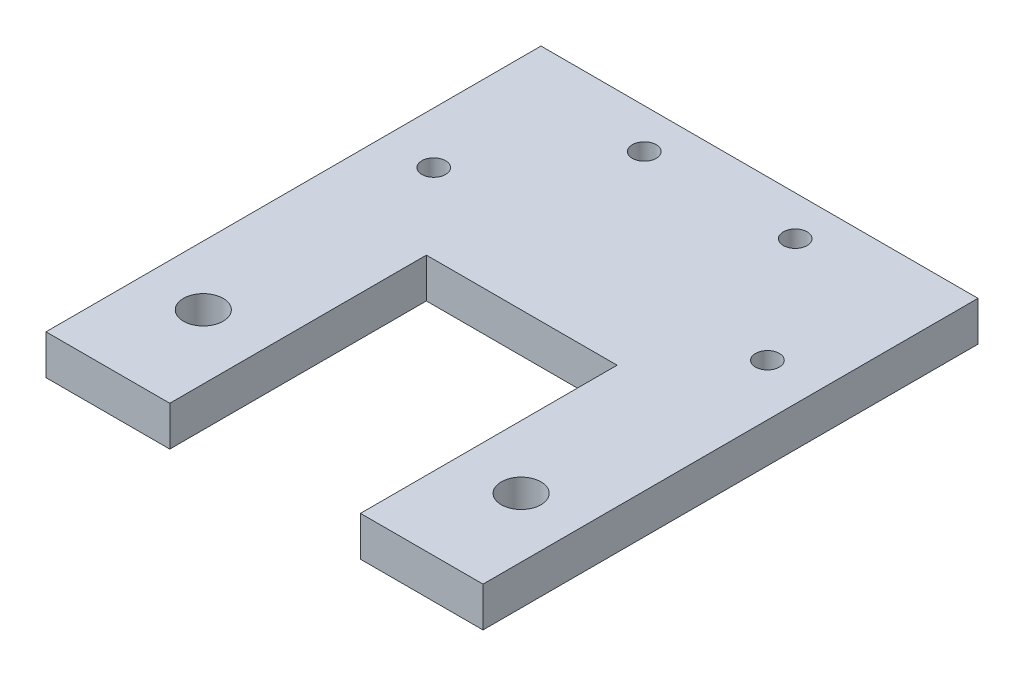
from build123d import *

# Parameters (mm, degrees)
SKETCH1_W           = 65
SKETCH1_H           = 100
BOSS_EXTRUDE1_DEPTH = 5
SKETCH3_R           = 1.5
SKETCH3_R_2         = 2.5
CUT_EXTRUDE2_DEPTH  = 5
SKETCH5_W           = 24
SKETCH5_H           = 70
CUT_EXTRUDE4_DEPTH  = 5
SKETCH6_W           = 65
SKETCH6_H           = 10
CUT_EXTRUDE5_DEPTH  = 5
SKETCH7_W           = 20.576460324
SKETCH7_H           = 27.703955477
CUT_EXTRUDE6_DEPTH  = 5
SKETCH8_W           = 20.423539676
SKETCH8_H           = 27.703955477
CUT_EXTRUDE7_DEPTH  = 5
CUT_EXTRUDE8_DEPTH  = 5
SKETCH10_W          = 5
SKETCH10_H          = 62.296044523
CUT_EXTRUDE9_DEPTH  = 5


with BuildPart() as part:
    # Sketch1 → Boss-Extrude1 (new body)
    with BuildSketch(Plane(origin=(0, 0, 0), x_dir=(1, 0, 0), z_dir=(0, 1, 0))):
        Rectangle(SKETCH1_W, SKETCH1_H)
    extrude(amount=BOSS_EXTRUDE1_DEPTH)

    # Sketch3 → Cut-Extrude2 (cut)
    with BuildSketch(Plane(origin=(0, 5, 0), x_dir=(1, 0, 0), z_dir=(0, 1, 0))):
        with Locations(Location((-21, 30, 0), (0, 0, 270))):
            Circle(SKETCH3_R)
        with Locations(Location((21, 30, 0), (0, 0, 270))):
            Circle(SKETCH3_R)
        with Locations(Location((-9.5, 45, 0), (0, 0, 270))):
            Circle(SKETCH3_R)
        with Locations(Location((9.5, 45, 0), (0, 0, 270))):
            Circle(SKETCH3_R)
        with Locations(Location((-20, 0, 0), (0, 0, 270))):
            Circle(SKETCH3_R_2)
        with Locations(Location((20, 0, 0), (0, 0, 270))):
            Circle(SKETCH3_R_2)
    extrude(amount=-CUT_EXTRUDE2_DEPTH, mode=Mode.SUBTRACT)

    # Sketch5 → Cut-Extrude4 (cut)
    with BuildSketch(Plane(origin=(0, 5, 0), x_dir=(1, 0, 0), z_dir=(0, 1, 0))):
        with Locations((0.076460324, -15)):
            Rectangle(SKETCH5_W, SKETCH5_H)
    extrude(amount=-CUT_EXTRUDE4_DEPTH, mode=Mode.SUBTRACT)

    # Sketch6 → Cut-Extrude5 (cut)
    with BuildSketch(Plane(origin=(0, 5, 0), x_dir=(1, 0, 0), z_dir=(0, 1, 0))):
        with Locations((0, -45)):
            Rectangle(SKETCH6_W, SKETCH6_H)
    extrude(amount=-CUT_EXTRUDE5_DEPTH, mode=Mode.SUBTRACT)

    # Sketch7 → Cut-Extrude6 (cut)
    with BuildSketch(Plane(origin=(0, 5, 0), x_dir=(1, 0, 0), z_dir=(0, 1, 0))):
        with Locations((-22.211769838, -26.148022261)):
            Rectangle(SKETCH7_W, SKETCH7_H)
    extrude(amount=-CUT_EXTRUDE6_DEPTH, mode=Mode.SUBTRACT)

    # Sketch8 → Cut-Extrude7 (cut)
    with BuildSketch(Plane(origin=(0, 5, 0), x_dir=(1, 0, 0), z_dir=(0, 1, 0))):
        with Locations((22.288230162, -26.148022261)):
            Rectangle(SKETCH8_W, SKETCH8_H)
    extrude(amount=-CUT_EXTRUDE7_DEPTH, mode=Mode.SUBTRACT)

    # Sketch9 → Cut-Extrude8 (cut)
    with BuildSketch(Plane(origin=(0, 5, 0), x_dir=(1, 0, 0), z_dir=(0, 1, 0))):
        Polygon((-27.5, 34.801314728), (-27.5, 50), (-32.5, 50), (-32.5, -12.296044523), (-27.5, -12.296044523), (-27.5, 18.851977738), align=None)
    extrude(amount=-CUT_EXTRUDE8_DEPTH, mode=Mode.SUBTRACT)

    # Sketch10 → Cut-Extrude9 (cut)
    with BuildSketch(Plane(origin=(0, 5, 0), x_dir=(1, 0, 0), z_dir=(0, 1, 0))):
        with Locations((30, 18.851977739)):
            Rectangle(SKETCH10_W, SKETCH10_H)
    extrude(amount=-CUT_EXTRUDE9_DEPTH, mode=Mode.SUBTRACT)


solid = part.part
